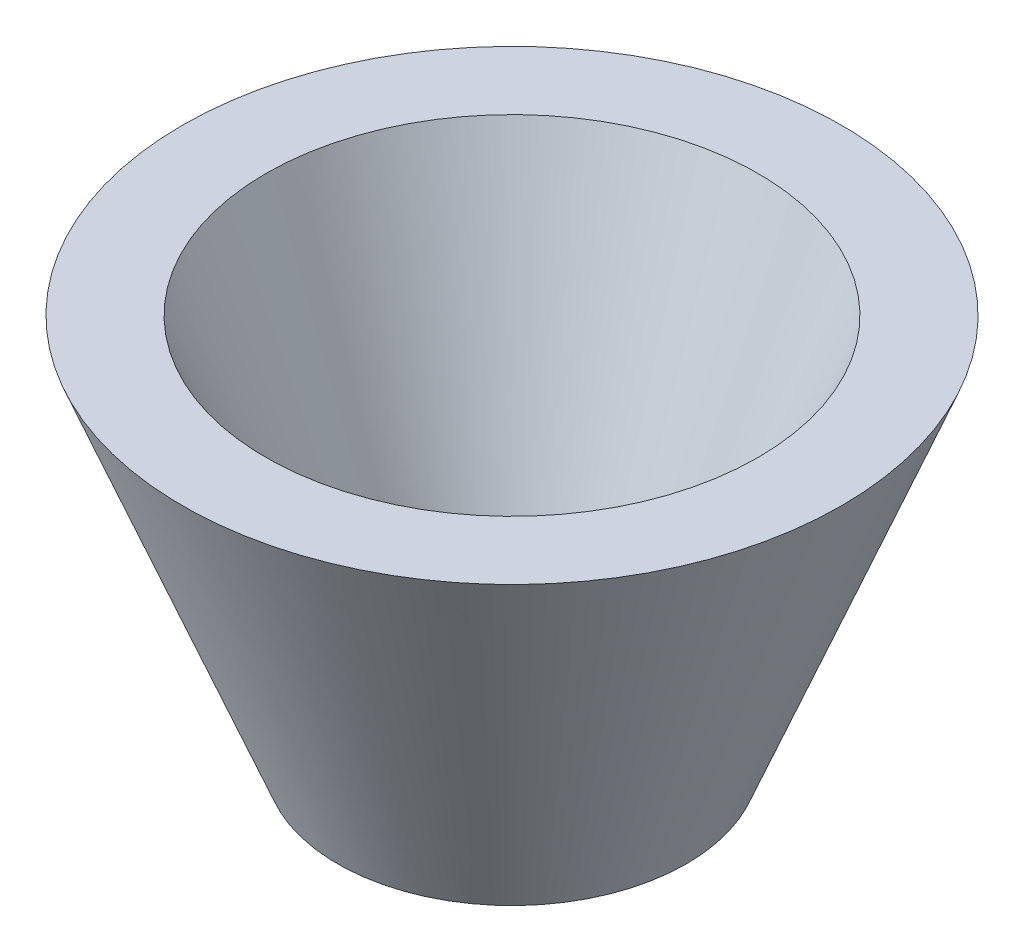
from build123d import *

# Parameters (mm, degrees)
SHELL_3_T = -2


with BuildPart() as part:
    # 草图1 → 旋转1 (revolve)
    with BuildSketch(Plane.XY, mode=Mode.PRIVATE) as revolve_1_sk:
        Polygon((0, 0), (4.5, 0), (8.5, 10), (0, 10), align=None)
    revolve(revolve_1_sk.sketch.rotate(Axis((0, 10, 0), (0, -1, 0)), 180), axis=Axis((0, 10, 0), (0, -1, 0)))

    # 抽壳3
    shell_3_openings = [part.faces().sort_by_distance(p)[0] for p in [
        (0, 10, 0),
    ]]
    offset(amount=SHELL_3_T, openings=shell_3_openings, kind=Kind.INTERSECTION)


solid = part.part
